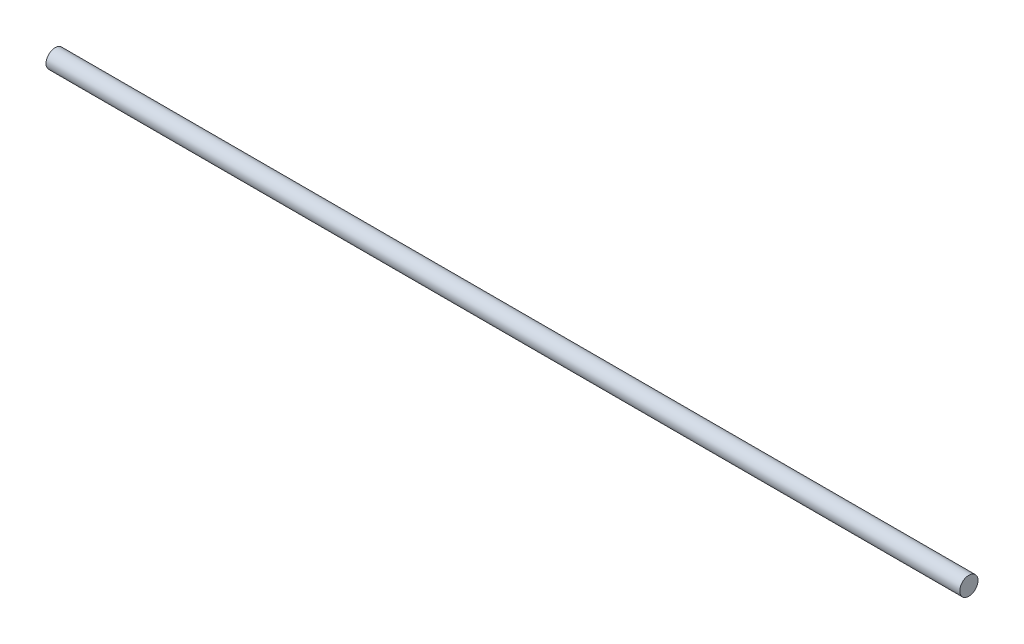
from build123d import *

# Parameters (mm, degrees)
SKETCH6_R           = 1.524
BOSS_EXTRUDE2_DEPTH = 76.2


with BuildPart() as part:
    # Sketch6 → Boss-Extrude2 (new, symmetric)
    with BuildSketch(Plane(origin=(0, 0, 0), x_dir=(0, 0, -1), z_dir=(1, 0, 0))):
        with Locations(Location((0, 0, 0), (0, 0, 180))):
            Circle(SKETCH6_R)
    extrude(amount=BOSS_EXTRUDE2_DEPTH, both=True)


solid = part.part
